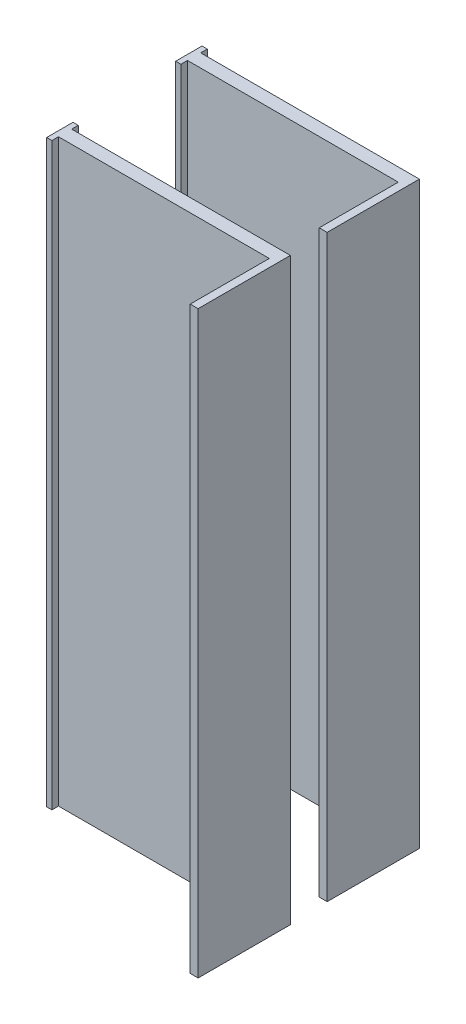
from build123d import *

# Parameters (mm, degrees)
EXTRUDE_1_DEPTH   = 220
EXTRUDE_1_2_DEPTH = 220


with BuildPart() as part:
    # 草图1 → 凸台-拉伸1 (new body)
    with BuildSketch(Plane(origin=(0, 0, 0), x_dir=(1, 0, 0), z_dir=(0, 1, 0))):
        Polygon((-40, 2.5), (-40, 5), (-42, 5), (-42, -5), (-40, -5), (-40, -2.5), (40, -2.5), (40, -32.5), (43, -32.5), (43, 2.5), (40, 2.5), align=None)
    extrude(amount=EXTRUDE_1_DEPTH)


with BuildPart() as body_2:
    # 草图1 → Extrude 1 2 (new body)
    with BuildSketch(Plane(origin=(0, 0, 0), x_dir=(1, 0, 0), z_dir=(0, 1, 0))):
        Polygon((-39.404935515, -47.054520884), (40.595064485, -47.054520884), (43.595064485, -47.054520884), (43.595064485, -82.054520884), (40.595064485, -82.054520884), (40.595064485, -52.054520884), (-39.404935515, -52.054520884), (-39.404935515, -54.554520884), (-41.404935515, -54.554520884), (-41.404935515, -44.554520884), (-39.404935515, -44.554520884), align=None)
    extrude(amount=EXTRUDE_1_2_DEPTH)


solid = Compound([part.part, body_2.part])
